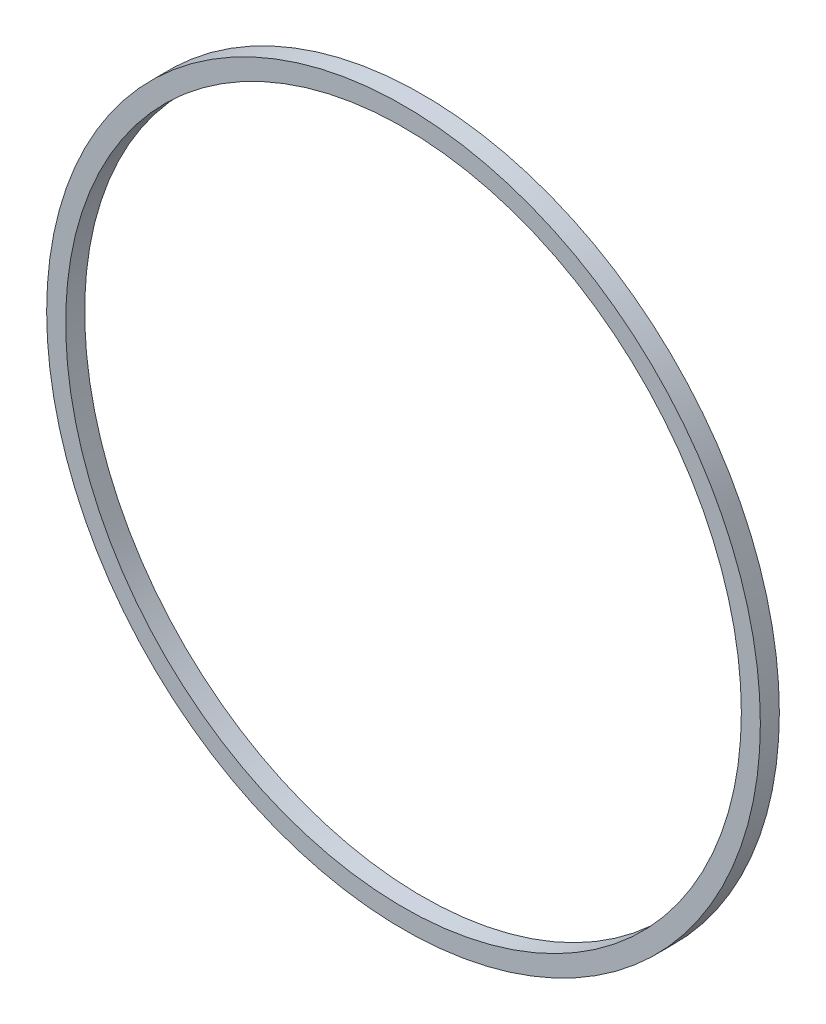
from build123d import *

# Parameters (mm, degrees)
CROQUIS1_R              = 42.25
CROQUIS1_R_2            = 40
SALIENTE_EXTRUIR1_DEPTH = 2.25


with BuildPart() as part:
    # Croquis1 → Saliente-Extruir1 (new body)
    with BuildSketch(Plane.XY):
        Circle(CROQUIS1_R)
        Circle(CROQUIS1_R_2, mode=Mode.SUBTRACT)
    extrude(amount=SALIENTE_EXTRUIR1_DEPTH)


solid = part.part
